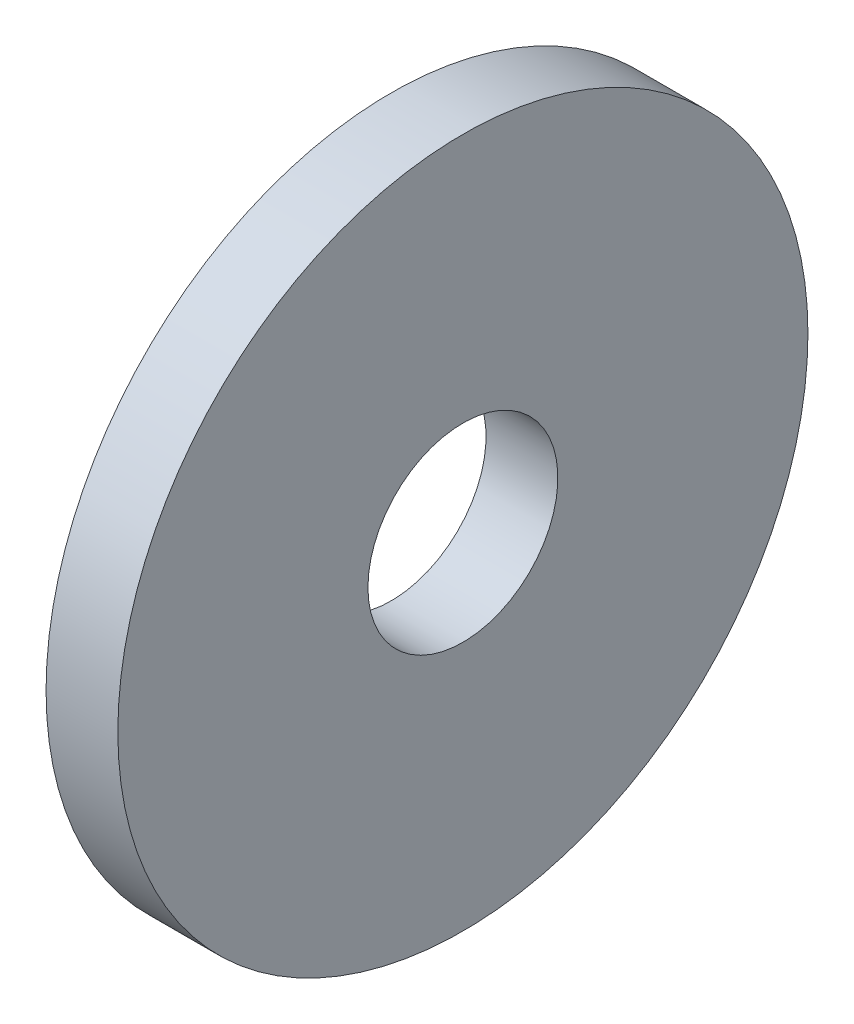
from build123d import *

# Parameters (mm, degrees)
SKETCH1_R           = 15.875
SKETCH1_R_2         = 4.3688
BOSS_EXTRUDE1_DEPTH = 3.302


with BuildPart() as part:
    # Sketch1 → Boss-Extrude1 (new body)
    with BuildSketch(Plane(origin=(0, 0, 0), x_dir=(0, 0, -1), z_dir=(1, 0, 0))):
        with Locations(Location((0, 0, 0), (0, 0, 180))):
            Circle(SKETCH1_R)
        with Locations(Location((0, 0, 0), (0, 0, 180))):
            Circle(SKETCH1_R_2, mode=Mode.SUBTRACT)
    extrude(amount=BOSS_EXTRUDE1_DEPTH)


solid = part.part
